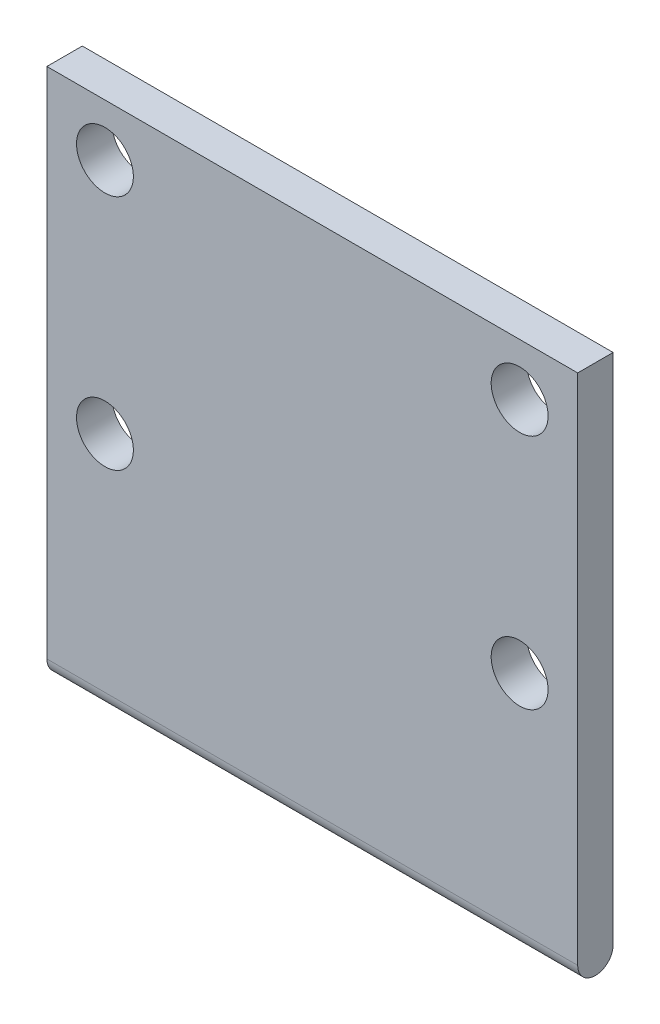
from build123d import *

# Parameters (mm, degrees)
SKETCH1_W            = 44.8
SKETCH1_H            = 2.99
BOSS_EXTRUDE1_DEPTH  = 44.8
FILLET1_RADIUS       = 1.495
FILLET1_LENGTH       = 44.8
M4_CLEARANCE_HOLE1_D = 4.8
SKETCH8_R            = 1.481852537
SKETCH8_R_2          = 1.249642824
BOSS_EXTRUDE2_DEPTH  = 6.99
REVOLVE1_ANGLE       = 180
REVOLVE2_ANGLE       = 180


with BuildPart() as part:
    # Sketch1 → Boss-Extrude1 (new body)
    with BuildSketch(Plane(origin=(0, 0, 0), x_dir=(1, 0, 0), z_dir=(0, 1, 0))):
        Rectangle(SKETCH1_W, SKETCH1_H)
    extrude(amount=BOSS_EXTRUDE1_DEPTH)

    # Fillet1: full round fillet: the end face becomes a half cylinder, R = half its width
    fillet1_face = Plane((0, 0, 0), x_dir=(-1, 0, 0), z_dir=(0, -1, 0))  # on the end face: x along it, z out of the body
    fillet1_slab = fillet1_face.offset(-FILLET1_RADIUS / 2) * Box(FILLET1_LENGTH, 2 * FILLET1_RADIUS, FILLET1_RADIUS, mode=Mode.PRIVATE)  # the body's end, R deep
    fillet1_round = Plane((0, 1.495, 0), x_dir=(0, -1, 0), z_dir=(-1, 0, 0)) * Cylinder(FILLET1_RADIUS, FILLET1_LENGTH, mode=Mode.PRIVATE)  # its axis R under the face
    add(fillet1_slab - fillet1_round, mode=Mode.SUBTRACT)

    # M4 Clearance Hole1 (through all)
    with Locations(Plane.XY.offset(1.495)):
        with Locations((-17.5, 40.4), (-17.5, 20.4), (17.5, 20.4), (17.5, 40.4)):
            Hole(M4_CLEARANCE_HOLE1_D / 2)

    # Sketch8 → Boss-Extrude2 (add)
    with BuildSketch(Plane.XY.offset(1.495)):
        with Locations((-7.5, 8.2)):
            Circle(SKETCH8_R)
        with Locations((7.5, 8.2)):
            Circle(SKETCH8_R_2)
    extrude(amount=-BOSS_EXTRUDE2_DEPTH)

    # Sketch9 → Revolve1 (revolve)
    with BuildSketch(Plane(origin=(0, 0, -5.495), x_dir=(-1, 0, 0), z_dir=(0, 0, -1))):
        with BuildLine():
            Line((7.5, 9.681852537), (7.5, 6.718147463))
            ThreePointArc((7.5, 6.718147463), (8.981852537, 8.2), (7.5, 9.681852537))
        make_face()
    revolve(axis=Axis((-7.5, 9.681852537, -5.495), (0, -1, 0)), revolution_arc=REVOLVE1_ANGLE)

    # Sketch10 → Revolve2 (revolve)
    with BuildSketch(Plane(origin=(0, 0, -5.495), x_dir=(-1, 0, 0), z_dir=(0, 0, -1))):
        with BuildLine():
            Line((-7.5, 9.449642824), (-7.5, 6.950357176))
            ThreePointArc((-7.5, 6.950357176), (-6.250357176, 8.2), (-7.5, 9.449642824))
        make_face()
    revolve(axis=Axis((7.5, 9.449642824, -5.495), (0, -1, 0)), revolution_arc=REVOLVE2_ANGLE)


solid = part.part
